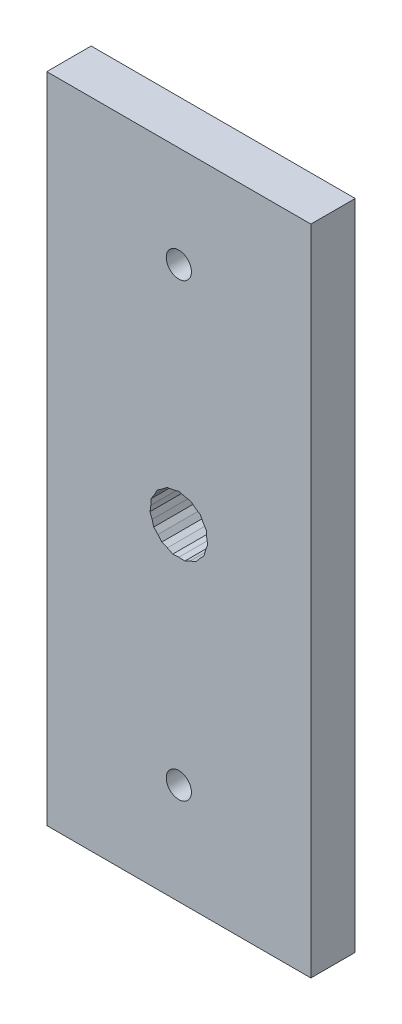
from build123d import *

# Parameters (mm, degrees)
MODEL_W             = 17.8592
MODEL_H             = 44.1523
BOSS_EXTRUDE1_DEPTH = 3
SKETCH2_R           = 0.8509
CUT_EXTRUDE1_DEPTH  = 48.721867314


with BuildPart() as part:
    # Model → Boss-Extrude1 (new body)
    with BuildSketch(Plane.XY):
        with Locations((8.9296, 22.07615)):
            Rectangle(MODEL_W, MODEL_H)
        Polygon((8.9296, 24.03615), (9.324632213, 23.934630441), (9.72680382, 23.866699097), (10.046391979, 23.613282289), (10.386163858, 23.387645988), (10.575048267, 23.02615), (10.793670772, 22.681823309), (10.819191601, 22.27475408), (10.878862915, 21.871274212), (10.736607381, 21.489017711), (10.627009791, 21.09615), (10.341575168, 20.804801848), (10.081659094, 20.490476691), (9.702399622, 20.34041363), (9.337106914, 20.158980703), (8.9296, 20.17615), (8.522093086, 20.158980703), (8.156800378, 20.34041363), (7.777540906, 20.490476691), (7.517624832, 20.804801848), (7.232190209, 21.09615), (7.122592619, 21.489017711), (6.980337085, 21.871274212), (7.040008399, 22.27475408), (7.065529228, 22.681823309), (7.284151733, 23.02615), (7.473036142, 23.387645988), (7.812808021, 23.613282289), (8.13239618, 23.866699097), (8.534567787, 23.934630441), align=None, mode=Mode.SUBTRACT)
    extrude(amount=BOSS_EXTRUDE1_DEPTH)

    # Sketch2 → Cut-Extrude1 (cut, through all)
    with BuildSketch(Plane.XY.offset(3)):
        with Locations((8.9296, 6.83615)):
            Circle(SKETCH2_R)
        with Locations(Location((8.9296, 37.31615, 0), (0, 0, 180))):
            Circle(SKETCH2_R)
    extrude(amount=-CUT_EXTRUDE1_DEPTH, mode=Mode.SUBTRACT)


solid = part.part
